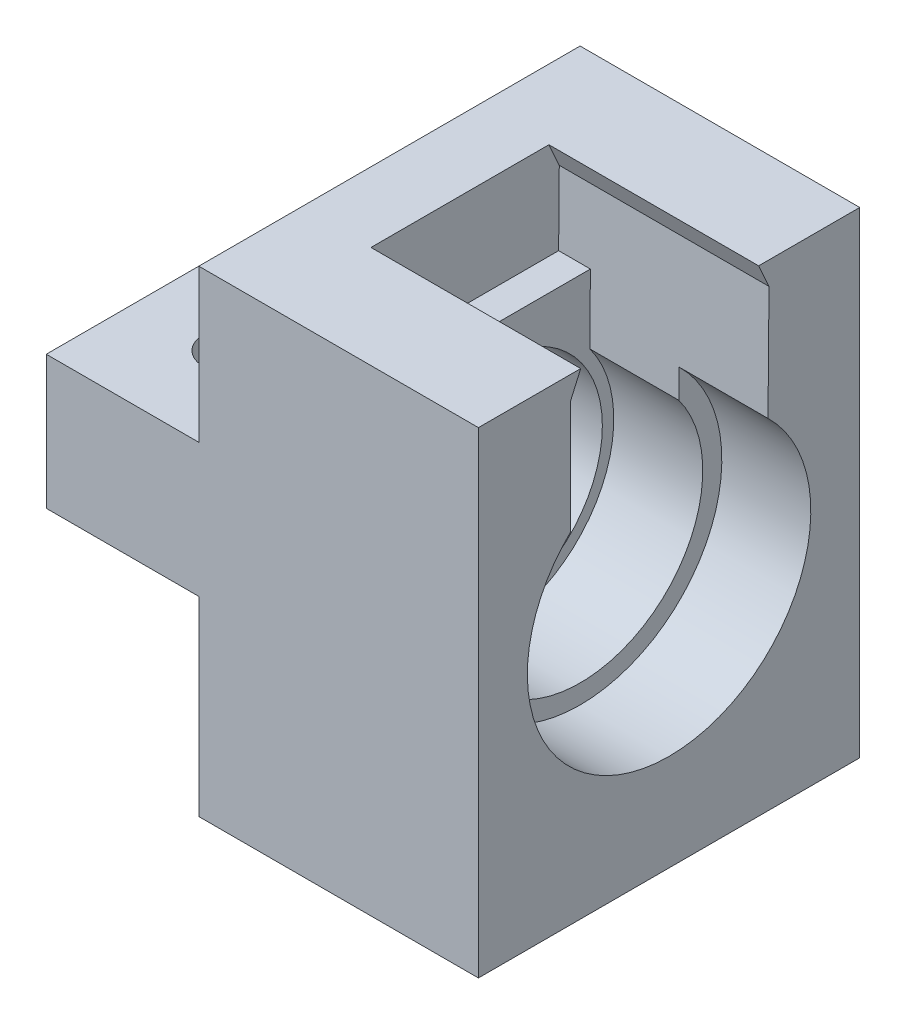
from build123d import *

# Parameters (mm, degrees)
EXTRUDE_491_DEPTH      = 30
CUT_EXTRUDE_1383_DEPTH = 19
CUT_EXTRUDE_1659_DEPTH = 14
CUT_EXTRUDE_2951_DEPTH = 7
CUT_EXTRUDE_5_DEPTH    = 16.5
CUT_EXTRUDE_6_REACH    = 54.022
SKETCH_3_R             = 2.15


with BuildPart() as part:
    # Sketch 319 → Extrude 491 (new body)
    with BuildSketch(Plane.XY):
        Polygon((0, 18.75), (0, -18.75), (-22, -18.75), (-22, -3.75), (-34, -3.75), (-34, 6.75), (-22, 6.75), (-22, 18.75), align=None)
    extrude(amount=EXTRUDE_491_DEPTH)

    # Эскиз2<5> → Cut-Extrude 1383 (cut)
    with BuildSketch(Plane(origin=(0, 0, 0), x_dir=(0, 0, -1), z_dir=(1, 0, 0))):
        with BuildLine():
            ThreePointArc((-22.752990961, 4.056307577), (-14.994684129, -8.749998385), (-7.251943403, 4.065724901))
            ThreePointArc((-7.251943403, 4.065724901), (-15.005315871, 8.749998385), (-22.752990961, 4.056307577))
        make_face()
    extrude(amount=-CUT_EXTRUDE_1383_DEPTH, mode=Mode.SUBTRACT)

    # Эскиз2<6> → Cut-Extrude 1659 (cut)
    with BuildSketch(Plane(origin=(0, 0, 0), x_dir=(0, 0, -1), z_dir=(1, 0, 0))):
        with BuildLine():
            ThreePointArc((-22.752278555, 5.746710121), (-15.008722765, -9.649996058), (-7.237345061, 5.732685958))
            Line((-7.237345061, 5.732685958), (-7.139195711, 16.940201189))
            Line((-7.139195711, 16.940201189), (-7.952107708, 18.75))
            Line((-7.952107708, 18.75), (-21.953209217, 18.75))
            Line((-21.953209217, 18.75), (-22.747558186, 16.94723086))
            Line((-22.747558186, 16.94723086), (-22.752278555, 5.746710121))
        make_face()
    extrude(amount=-CUT_EXTRUDE_1659_DEPTH, mode=Mode.SUBTRACT)

    # Sketch 557 → Cut-Extrude 2951 (cut)
    with BuildSketch(Plane(origin=(0, 0, 0), x_dir=(0, 0, -1), z_dir=(1, 0, 0))):
        with BuildLine():
            Line((-22.752278555, 5.746710121), (-22.751322621, 8.014954624))
            ThreePointArc((-22.751322621, 8.014954624), (-19.352887132, -10.265226428), (-3.85, 0))
            ThreePointArc((-3.85, 0), (-4.726344075, 4.332954411), (-7.21762223, 7.984804083))
            Line((-7.21762223, 7.984804083), (-7.237345061, 5.732685958))
            ThreePointArc((-7.237345061, 5.732685958), (-5.833972503, 3.017687843), (-5.35, 0))
            ThreePointArc((-5.35, 0), (-18.025971906, -9.163296024), (-22.752278555, 5.746710121))
        make_face()
    extrude(amount=-CUT_EXTRUDE_2951_DEPTH, mode=Mode.SUBTRACT)

    # Эскиз под резистор и подшипник<7> → Вырез-Вытянуть5 (cut)
    with BuildSketch(Plane(origin=(0, 0, 0), x_dir=(0, 0, -1), z_dir=(1, 0, 0))):
        Polygon((-22.747558186, 16.94723086), (-22.750001382, 11.15), (-15, 11.15), (-7.189903158, 11.15), (-7.139195711, 16.940201189), (-7.952107708, 18.75), (-21.953209217, 18.75), align=None)
    extrude(amount=-CUT_EXTRUDE_5_DEPTH, mode=Mode.SUBTRACT)

    # Эскиз3 → Вырез-Вытянуть6 (cut, up to next)
    with BuildSketch(Plane(origin=(0, 6.75, 0), x_dir=(1, 0, 0), z_dir=(0, 1, 0)), mode=Mode.PRIVATE) as cut_extrude_6_sk1:
        with Locations((-27, -7.5)):
            Circle(SKETCH_3_R)
    cut_extrude_6_tool1 = extrude(cut_extrude_6_sk1.sketch, amount=-CUT_EXTRUDE_6_REACH, mode=Mode.PRIVATE) & part.part
    # Эскиз3 → Вырез-Вытянуть6 (cut, up to next)
    with BuildSketch(Plane(origin=(0, 6.75, 0), x_dir=(1, 0, 0), z_dir=(0, 1, 0)), mode=Mode.PRIVATE) as cut_extrude_6_sk2:
        with Locations((-27, -22.5)):
            Circle(SKETCH_3_R)
    cut_extrude_6_tool2 = extrude(cut_extrude_6_sk2.sketch, amount=-CUT_EXTRUDE_6_REACH, mode=Mode.PRIVATE) & part.part
    add(cut_extrude_6_tool1.solids().sort_by_distance((-27, 6.75, 7.5))[0], mode=Mode.SUBTRACT)
    add(cut_extrude_6_tool2.solids().sort_by_distance((-27, 6.75, 22.5))[0], mode=Mode.SUBTRACT)


solid = part.part
